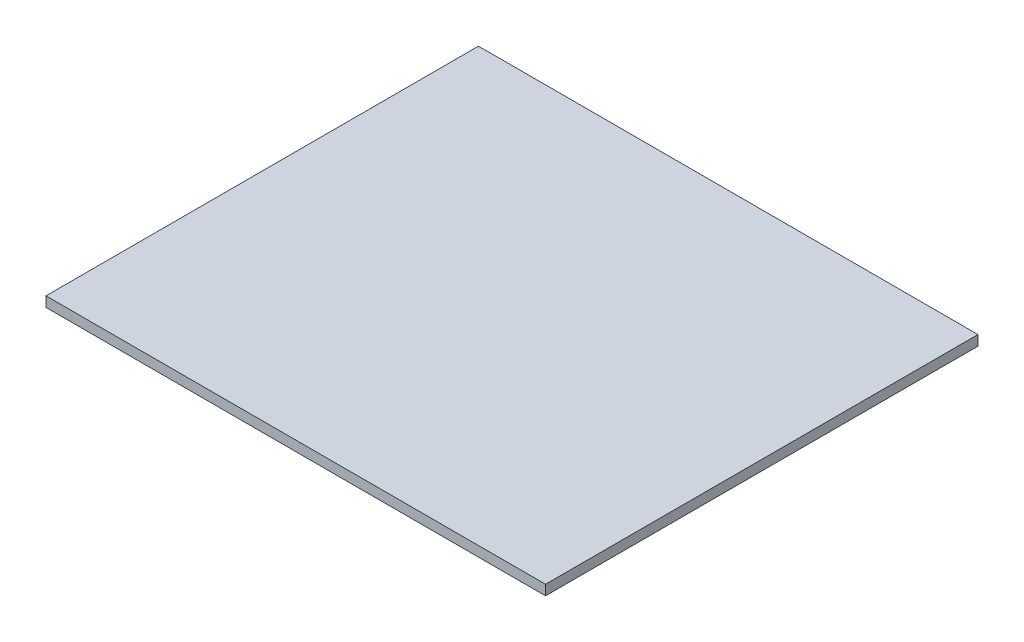
from build123d import *

# Parameters (mm, degrees)
SKETCH1_W           = 149
SKETCH1_H           = 129
BOSS_EXTRUDE1_DEPTH = 3


with BuildPart() as part:
    # Sketch1 → Boss-Extrude1 (new body)
    with BuildSketch(Plane(origin=(0, 0, 0), x_dir=(1, 0, 0), z_dir=(0, 1, 0))):
        Rectangle(SKETCH1_W, SKETCH1_H)
    extrude(amount=BOSS_EXTRUDE1_DEPTH)


solid = part.part
